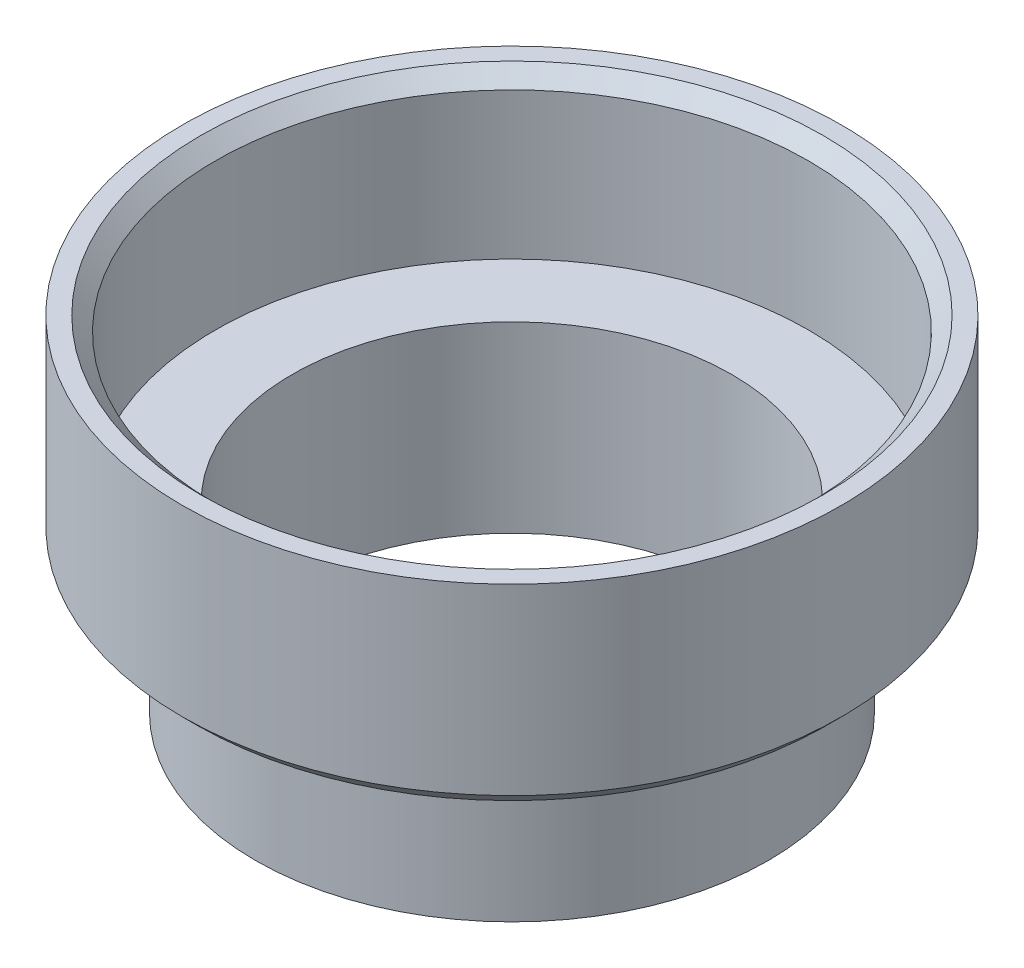
from build123d import *

# Parameters (mm, degrees)
SCHIZZO1_R        = 35
SCHIZZO1_R_2      = 30
ESTRUSIONE1_DEPTH = 30
ESTRUSIONE2_START = -10
SCHIZZO2_R        = 45
SCHIZZO2_R_2      = 30
ESTRUSIONE2_DEPTH = 5
SCHIZZO3_R        = 45
SCHIZZO3_R_2      = 40.5
ESTRUSIONE3_DEPTH = 22
SMUSSO1_SIZE      = 2
SMUSSO2_SIZE      = 2
SCHIZZO4_R        = 40.5
ESTRUSIONE4_DEPTH = 20


with BuildPart() as part:
    # Schizzo1 → Estrusione1 (new body)
    with BuildSketch(Plane(origin=(0, 0, 0), x_dir=(1, 0, 0), z_dir=(0, 1, 0))):
        with Locations(Location((0, 0, 0), (0, 0, 270))):
            Circle(SCHIZZO1_R)
        with Locations(Location((0, 0, 0), (0, 0, 270))):
            Circle(SCHIZZO1_R_2, mode=Mode.SUBTRACT)
    extrude(amount=ESTRUSIONE1_DEPTH)

    # Schizzo2 → Estrusione2 (add)
    with BuildSketch(Plane(origin=(0, 30, 0), x_dir=(1, 0, 0), z_dir=(0, 1, 0)).offset(ESTRUSIONE2_START)):
        with Locations(Location((0, 0, 0), (0, 0, 270))):
            Circle(SCHIZZO2_R)
        with Locations(Location((0, 0, 0), (0, 0, 270))):
            Circle(SCHIZZO2_R_2, mode=Mode.SUBTRACT)
    extrude(amount=ESTRUSIONE2_DEPTH)

    # Schizzo3 → Estrusione3 (add)
    with BuildSketch(Plane(origin=(0, 25, 0), x_dir=(1, 0, 0), z_dir=(0, 1, 0))):
        with Locations(Location((0, 0, 0), (0, 0, 270))):
            Circle(SCHIZZO3_R)
        with Locations(Location((0, 0, 0), (0, 0, 270))):
            Circle(SCHIZZO3_R_2, mode=Mode.SUBTRACT)
    extrude(amount=ESTRUSIONE3_DEPTH)

    # Smusso1
    smusso1_edges = [part.edges().sort_by_distance(p)[0] for p in [
        (0, 20, -45),
    ]]
    chamfer(smusso1_edges, length=SMUSSO1_SIZE)

    # Smusso2
    smusso2_edges = [part.edges().sort_by_distance(p)[0] for p in [
        (0, 47, -40.5),
    ]]
    chamfer(smusso2_edges, length=SMUSSO2_SIZE)

    # Schizzo4 → Estrusione4 (cut)
    with BuildSketch(Plane(origin=(0, 25, 0), x_dir=(1, 0, 0), z_dir=(0, 1, 0))):
        with Locations(Location((0, 0, 0), (0, 0, 270))):
            Circle(SCHIZZO4_R)
    extrude(amount=ESTRUSIONE4_DEPTH, mode=Mode.SUBTRACT)


solid = part.part
